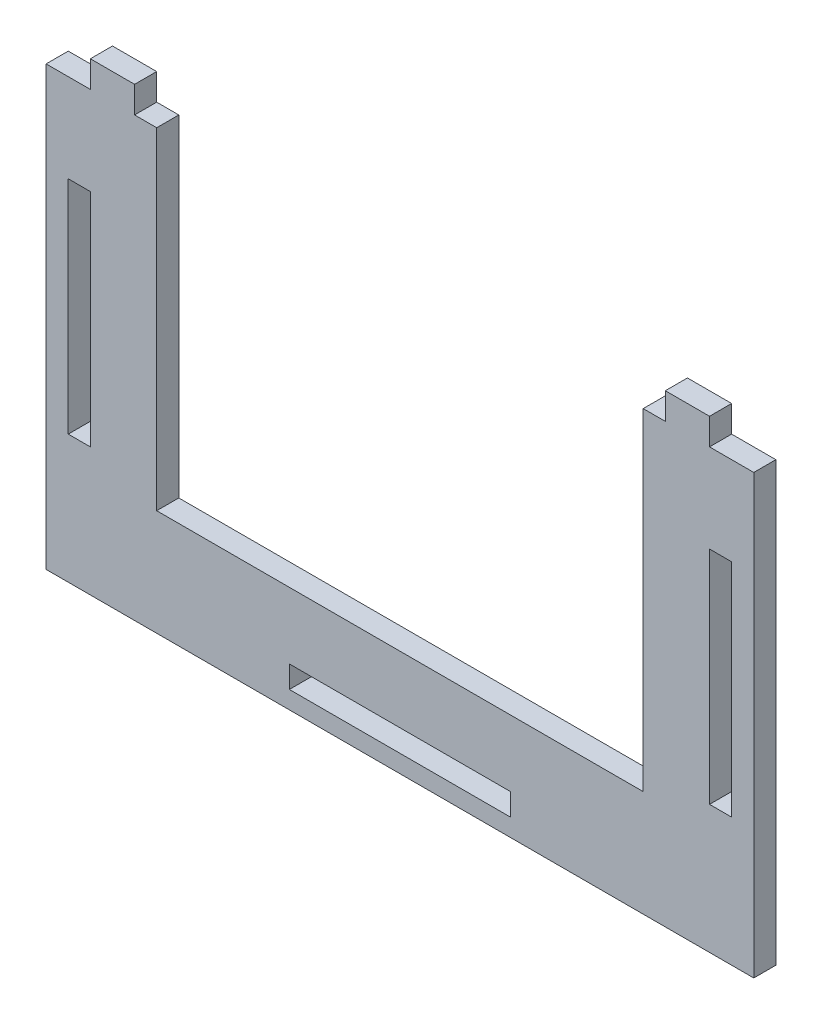
from build123d import *

# Parameters (mm, degrees)
SKETCH1_W           = 31.75
SKETCH1_H           = 3.175
SKETCH1_W_2         = 3.175
SKETCH1_H_2         = 31.75
BOSS_EXTRUDE1_DEPTH = 3.175


with BuildPart() as part:
    # Sketch1 → Boss-Extrude1 (new body)
    with BuildSketch(Plane.XY):
        Polygon((-50.8, 28.575), (-44.45, 28.575), (-44.45, 32.385), (-38.1, 32.385), (-38.1, 28.575), (-34.925, 28.575), (-34.925, -19.05), (34.925, -19.05), (34.925, 28.575), (38.1, 28.575), (38.1, 32.385), (44.45, 32.385), (44.45, 28.575), (50.8, 28.575), (50.8, -34.29), (-50.8, -34.29), align=None)
        with Locations((0, -30.1625)):
            Rectangle(SKETCH1_W, SKETCH1_H, mode=Mode.SUBTRACT)
        with Locations((-46.0375, 0)):
            Rectangle(SKETCH1_W_2, SKETCH1_H_2, mode=Mode.SUBTRACT)
        with Locations((46.0375, 0)):
            Rectangle(SKETCH1_W_2, SKETCH1_H_2, mode=Mode.SUBTRACT)
    extrude(amount=BOSS_EXTRUDE1_DEPTH)


solid = part.part
